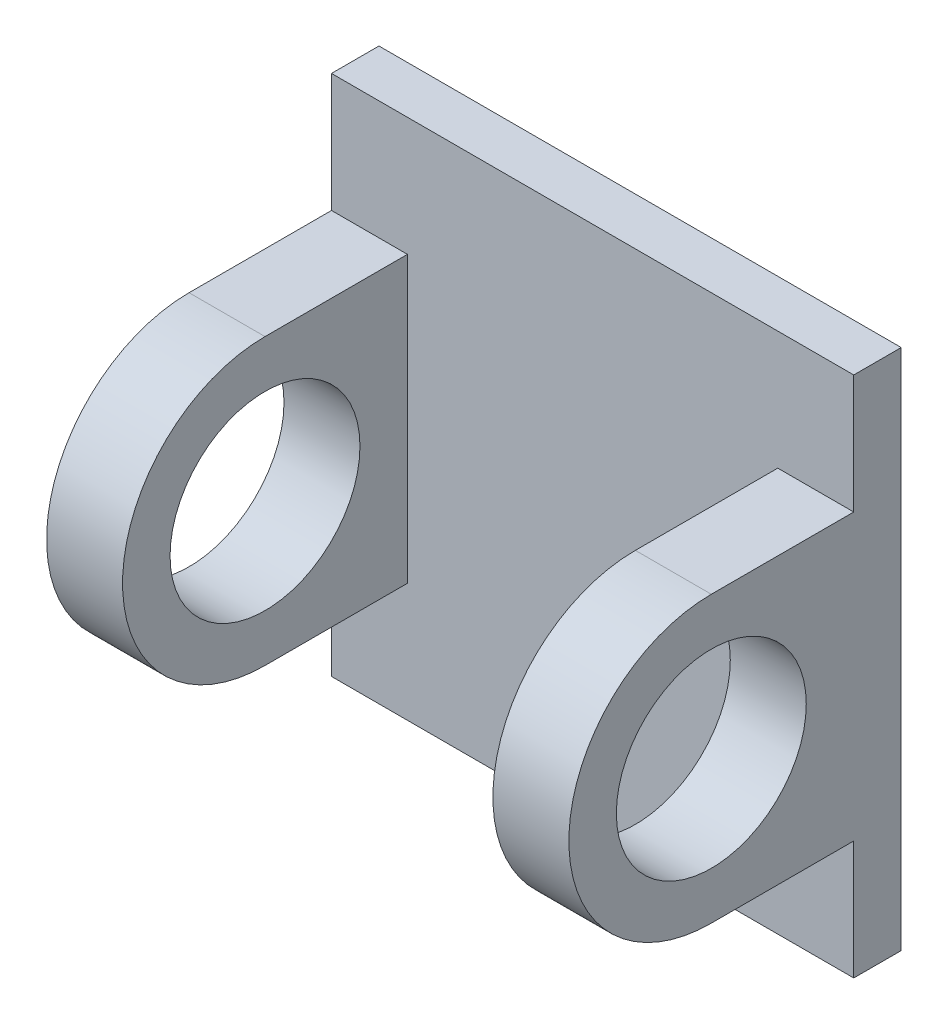
from build123d import *

# Parameters (mm, degrees)
SKETCH1_W               = 27.5
SKETCH1_H               = 27.5
BOSS_EXTRUDE1_DEPTH     = 2.5
SKETCH2_R               = 5
BOSS_EXTRUDE2_DEPTH     = 27.5
CUT_EXTRUDE1_DEPTH      = 9.75
CUT_EXTRUDE1_DEPTH_BACK = 9.75
SKETCH3_W               = 27.5
SKETCH3_H               = 15.762918275


with BuildPart() as part:
    # Sketch1 → Boss-Extrude1 (new body)
    with BuildSketch(Plane(origin=(0, 0, 0), x_dir=(0, 1, 0), z_dir=(0, 0, 1))):
        Rectangle(SKETCH1_W, SKETCH1_H)
    extrude(amount=BOSS_EXTRUDE1_DEPTH)

    # Sketch2 → Boss-Extrude2 (add)
    with BuildSketch(Plane.YZ.offset(13.75)):
        with BuildLine():
            Line((-7.5, 2.5), (7.5, 2.5))
            Line((7.5, 2.5), (7.5, 10))
            ThreePointArc((7.5, 10), (0, 17.5), (-7.5, 10))
            Line((-7.5, 10), (-7.5, 2.5))
        make_face()
        with Locations(Location((0, 10, 0), (0, 0, 270))):
            Circle(SKETCH2_R, mode=Mode.SUBTRACT)
    extrude(amount=-BOSS_EXTRUDE2_DEPTH)

    # Sketch3 → Cut-Extrude1 (cut, two sides: drawn at the far end of the back side and taken through both)
    with BuildSketch(Plane.YZ.offset(-CUT_EXTRUDE1_DEPTH_BACK)):
        with Locations((0, 10.381459138)):
            Rectangle(SKETCH3_W, SKETCH3_H)
    extrude(amount=CUT_EXTRUDE1_DEPTH + CUT_EXTRUDE1_DEPTH_BACK, mode=Mode.SUBTRACT)


solid = part.part
